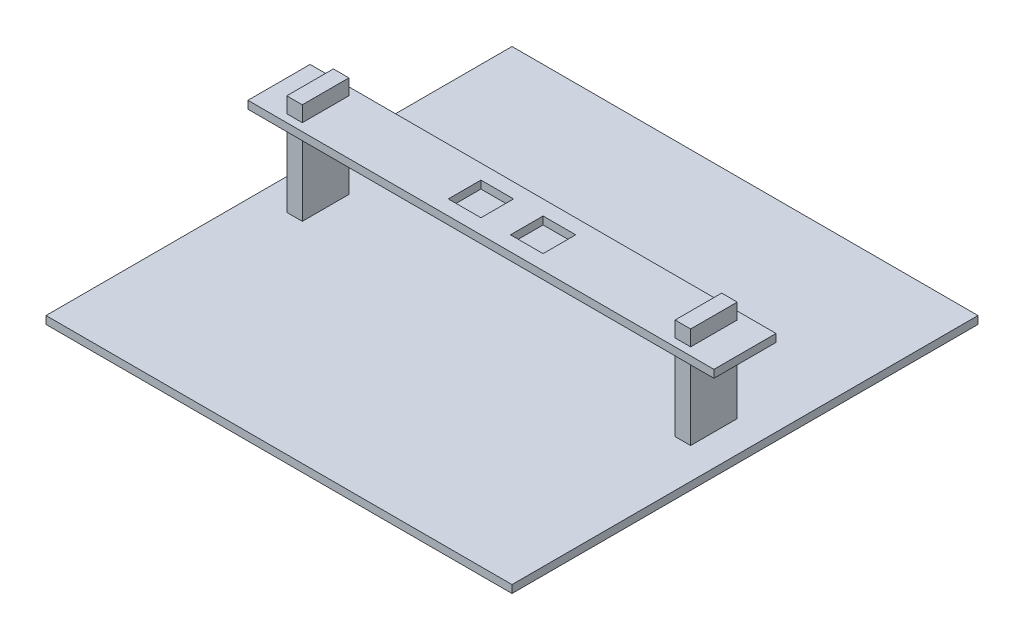
from build123d import *

# Parameters (mm, degrees)
SKETCH1_W           = 600
SKETCH1_H           = 600
BOSS_EXTRUDE1_DEPTH = 10
SKETCH2_W           = 20
SKETCH2_H           = 60
BOSS_EXTRUDE2_DEPTH = 130
SKETCH3_W           = 600
SKETCH3_H           = 600
SKETCH3_W_2         = 20
SKETCH3_H_2         = 60
BOSS_EXTRUDE3_DEPTH = 10
SKETCH4_OUTSIDE_W   = 774
SKETCH4_OUTSIDE_H   = 774
SKETCH4_OUTSIDE_W_2 = 600
SKETCH4_OUTSIDE_H_2 = 80
CUT_EXTRUDE1_DEPTH  = 10
SKETCH5_W           = 42
SKETCH5_H           = 42
CUT_EXTRUDE2_DEPTH  = 10


with BuildPart() as part:
    # Sketch1 → Boss-Extrude1 (new body)
    with BuildSketch(Plane(origin=(0, 0, 0), x_dir=(1, 0, 0), z_dir=(0, 1, 0))):
        Rectangle(SKETCH1_W, SKETCH1_H)
    extrude(amount=BOSS_EXTRUDE1_DEPTH)

    # Sketch2 → Boss-Extrude2 (add)
    with BuildSketch(Plane(origin=(0, 10, 0), x_dir=(1, 0, 0), z_dir=(0, 1, 0))):
        with Locations((-250, 0)):
            Rectangle(SKETCH2_W, SKETCH2_H)
        with Locations((250, 0)):
            Rectangle(SKETCH2_W, SKETCH2_H)
    extrude(amount=BOSS_EXTRUDE2_DEPTH)

    # Sketch3 → Boss-Extrude3 (add)
    with BuildSketch(Plane(origin=(0, 110, 0), x_dir=(1, 0, 0), z_dir=(0, 1, 0))):
        Rectangle(SKETCH3_W, SKETCH3_H)
        with Locations((-250, 0)):
            Rectangle(SKETCH3_W_2, SKETCH3_H_2, mode=Mode.SUBTRACT)
        with Locations((250, 0)):
            Rectangle(SKETCH3_W_2, SKETCH3_H_2, mode=Mode.SUBTRACT)
    extrude(amount=BOSS_EXTRUDE3_DEPTH)

    # Sketch4 outside → Cut-Extrude1 (cut)
    with BuildSketch(Plane(origin=(0, 120, 0), x_dir=(1, 0, 0), z_dir=(0, 1, 0))):
        Rectangle(SKETCH4_OUTSIDE_W, SKETCH4_OUTSIDE_H)
        Rectangle(SKETCH4_OUTSIDE_W_2, SKETCH4_OUTSIDE_H_2, mode=Mode.SUBTRACT)
    extrude(amount=-CUT_EXTRUDE1_DEPTH, mode=Mode.SUBTRACT)

    # Sketch5 → Cut-Extrude2 (cut)
    with BuildSketch(Plane(origin=(0, 120, 0), x_dir=(1, 0, 0), z_dir=(0, 1, 0))):
        with Locations((-40, 0)):
            Rectangle(SKETCH5_W, SKETCH5_H)
        with Locations((40, 0)):
            Rectangle(SKETCH5_W, SKETCH5_H)
    extrude(amount=-CUT_EXTRUDE2_DEPTH, mode=Mode.SUBTRACT)


solid = part.part
